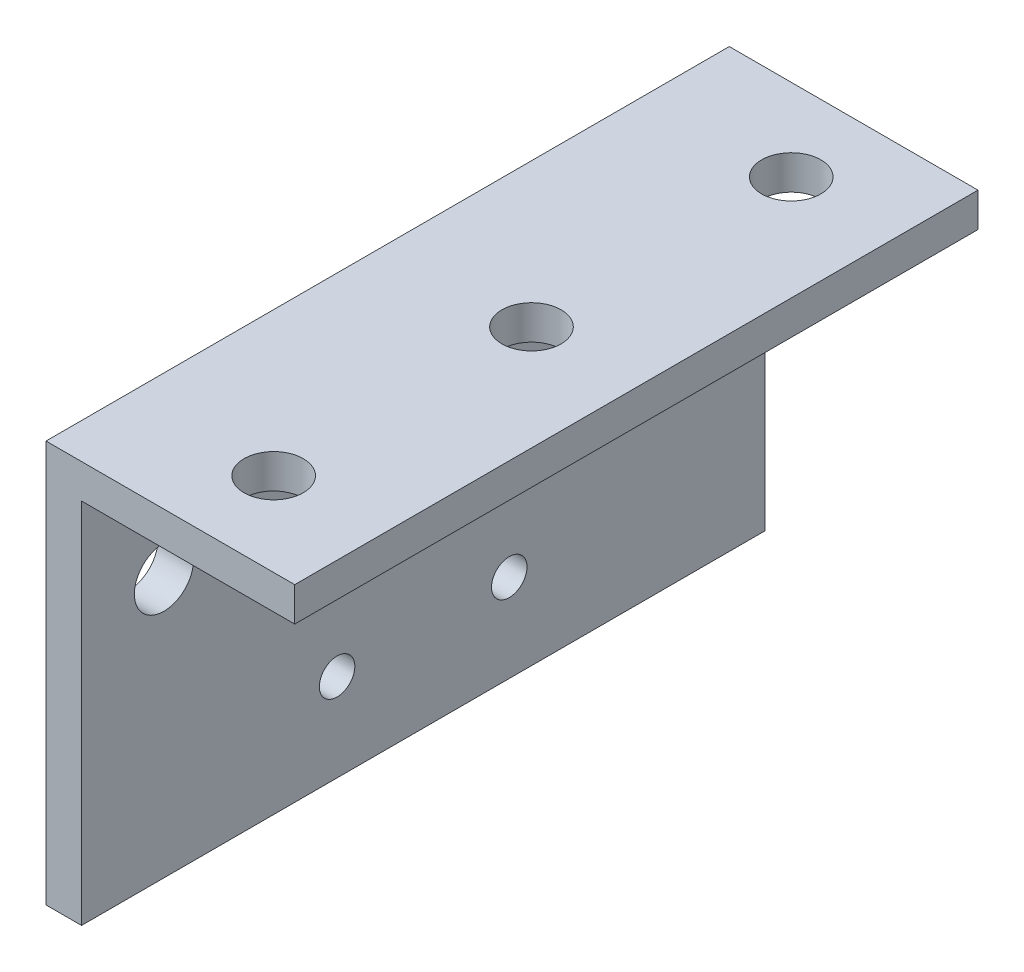
from build123d import *

# Parameters (mm, degrees)
BOSS_EXTRUDE1_DEPTH         = 63.5
M5_CLEARANCE_HOLE1_D        = 5.5
M5_CLEARANCE_HOLE2_D        = 5.5
M5_CLEARANCE_HOLE3_D        = 5.5
M5_CLEARANCE_HOLE4_D        = 5.5
M5_CLEARANCE_HOLE5_D        = 5.5
TAP_DRILL_FOR_M4X0_7_TAP2_D = 3.3


with BuildPart() as part:
    # Sketch1 → Boss-Extrude1 (new body)
    with BuildSketch(Plane.XY):
        Polygon((0, 0), (0, 37.338), (23.114, 37.338), (23.114, 34.163), (3.302, 34.163), (3.302, 0), align=None)
    extrude(amount=BOSS_EXTRUDE1_DEPTH)

    # M5 Clearance Hole1 (through all)
    with Locations(Plane.ZY):
        with Locations((55.84134748, 24.208221519)):
            Hole(M5_CLEARANCE_HOLE1_D / 2)

    # M5 Clearance Hole2 (through all)
    with Locations(Plane.ZY):
        with Locations((7.677638483, 24.208221519)):
            Hole(M5_CLEARANCE_HOLE2_D / 2)

    # M5 Clearance Hole3 (through all)
    with Locations(Plane(origin=(0, 37.338, 0), x_dir=(1, 0, 0), z_dir=(0, 1, 0))):
        with Locations((13.368582087, -31.75)):
            Hole(M5_CLEARANCE_HOLE3_D / 2)

    # M5 Clearance Hole4 (through all)
    with Locations(Plane(origin=(0, 37.338, 0), x_dir=(1, 0, 0), z_dir=(0, 1, 0))):
        with Locations((13.368582087, -55.713693276)):
            Hole(M5_CLEARANCE_HOLE4_D / 2)

    # M5 Clearance Hole5 (through all)
    with Locations(Plane(origin=(0, 37.338, 0), x_dir=(1, 0, 0), z_dir=(0, 1, 0))):
        with Locations((13.368582087, -7.610649616)):
            Hole(M5_CLEARANCE_HOLE5_D / 2)

    # Tap Drill for M4x0.7 Tap2 (through all)
    with Locations(Plane.ZY):
        with Locations((23.75, 24.163), (23.75, 8.163), (39.75, 8.163), (39.75, 24.163)):
            Hole(TAP_DRILL_FOR_M4X0_7_TAP2_D / 2)


solid = part.part
